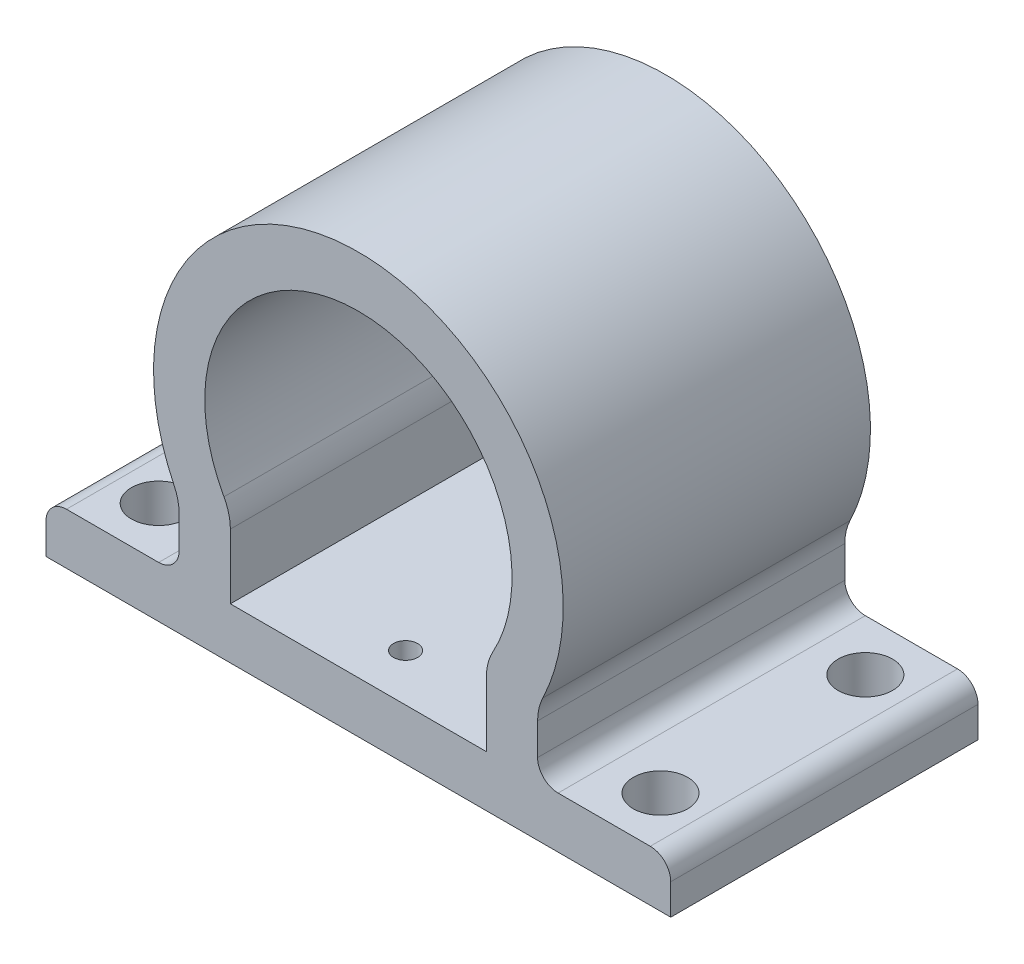
from build123d import *

# Parameters (mm, degrees)
BOSS_EXTRUDE1_DEPTH = 38.1
FILLET1_R           = 6.35
CUT_EXTRUDE1_REACH  = 71.34
SKETCH2_R           = 1.7
SKETCH2_3_R         = 3
SKETCH2_3_R_2       = 1.7
CUT_EXTRUDE2_DEPTH  = 6.35
SKETCH5_W           = 38.1
SKETCH5_H           = 6.35
BOSS_EXTRUDE3_DEPTH = 16.51
SKETCH6_R           = 3.3782
CUT_EXTRUDE3_DEPTH  = 76.254867783
FILLET2_R           = 2.54
BOSS_EXTRUDE4_START = -2.54
SKETCH7_R           = 3
SKETCH7_R_2         = 1.5
BOSS_EXTRUDE4_DEPTH = 2.54


with BuildPart() as part:
    # Sketch1 → Boss-Extrude1 (new body)
    with BuildSketch(Plane.XY):
        with BuildLine():
            Line((22.225, -26.67), (22.225, -12.296722124))
            ThreePointArc((22.225, -12.296722124), (0, 25.4), (-22.225, -12.296722124))
            Line((-22.225, -12.296722124), (-22.225, -26.67))
            Line((-22.225, -26.67), (22.225, -26.67))
        make_face()
        with BuildLine():
            Line((-15.875, -20.32), (15.875, -20.32))
            Line((15.875, -20.32), (15.875, -10.530283709))
            ThreePointArc((15.875, -10.530283709), (0, 19.05), (-15.875, -10.530283709))
            Line((-15.875, -10.530283709), (-15.875, -20.32))
        make_face(mode=Mode.SUBTRACT)
    extrude(amount=BOSS_EXTRUDE1_DEPTH)

    # Fillet1
    fillet1_edges = [part.edges().sort_by_distance(p)[0] for p in [
        (22.225, -12.296722124, 19.05),
        (15.875, -10.530283709, 19.05),
        (-22.225, -12.296722124, 19.05),
        (-15.875, -10.530283709, 19.05),
    ]]
    fillet(fillet1_edges, radius=FILLET1_R)

    # Sketch2 → Cut-Extrude1 (cut, up to next)
    with BuildSketch(Plane.XZ.offset(26.67), mode=Mode.PRIVATE) as cut_extrude1_sk1:
        with Locations((0, 32.2471478)):
            Circle(SKETCH2_R)
    cut_extrude1_tool1 = extrude(cut_extrude1_sk1.sketch, amount=-CUT_EXTRUDE1_REACH, mode=Mode.PRIVATE) & part.part
    # Sketch2 → Cut-Extrude1 (cut, up to next)
    with BuildSketch(Plane.XZ.offset(26.67), mode=Mode.PRIVATE) as cut_extrude1_sk2:
        with Locations((0, 13.2471478)):
            Circle(SKETCH2_R)
    cut_extrude1_tool2 = extrude(cut_extrude1_sk2.sketch, amount=-CUT_EXTRUDE1_REACH, mode=Mode.PRIVATE) & part.part
    add(cut_extrude1_tool1.solids().sort_by_distance((0, -26.67, 32.247148))[0], mode=Mode.SUBTRACT)
    add(cut_extrude1_tool2.solids().sort_by_distance((0, -26.67, 13.247148))[0], mode=Mode.SUBTRACT)

    # Sketch2<3> → Cut-Extrude2 (cut)
    # profile 1 of 2: a face of its own
    with BuildSketch(Plane.XZ.offset(26.67)):
        with Locations((0, 32.2471478)):
            Circle(SKETCH2_3_R)
        with Locations((0, 32.2471478)):
            Circle(SKETCH2_3_R_2, mode=Mode.SUBTRACT)
    # profile 2 of 2: a face of its own
    with BuildSketch(Plane.XZ.offset(26.67)):
        with Locations((0, 13.2471478)):
            Circle(SKETCH2_3_R)
        with Locations((0, 13.2471478)):
            Circle(SKETCH2_3_R_2, mode=Mode.SUBTRACT)
    extrude(amount=-CUT_EXTRUDE2_DEPTH, mode=Mode.SUBTRACT)

    # Sketch5 → Boss-Extrude3 (add)
    with BuildSketch(Plane.ZY.offset(22.225)):
        with Locations((19.05, -23.495)):
            Rectangle(SKETCH5_W, SKETCH5_H)
    boss_extrude3 = extrude(amount=BOSS_EXTRUDE3_DEPTH)

    # Sketch6 → Cut-Extrude3 (cut, through all)
    with BuildSketch(Plane(origin=(0, -26.67, 0), x_dir=(-1, 0, 0), z_dir=(0, -1, 0))):
        with Locations((31.115, -6.35)):
            Circle(SKETCH6_R)
        with Locations((31.115, -31.75)):
            Circle(SKETCH6_R)
    cut_extrude3 = extrude(amount=-CUT_EXTRUDE3_DEPTH, mode=Mode.SUBTRACT)

    # Mirror1: Boss-Extrude3, Cut-Extrude3 across plane
    add(boss_extrude3.mirror(Plane(origin=(0, 0, 0), x_dir=(0, 0, 1), z_dir=(1, 0, 0))))
    add(cut_extrude3.mirror(Plane(origin=(0, 0, 0), x_dir=(0, 0, 1), z_dir=(1, 0, 0))), mode=Mode.SUBTRACT)

    # Fillet2
    fillet2_edges = [part.edges().sort_by_distance(p)[0] for p in [
        (38.735, -20.32, 19.05),
        (22.225, -20.32, 19.05),
        (-38.735, -20.32, 19.05),
        (-22.225, -20.32, 19.05),
    ]]
    fillet(fillet2_edges, radius=FILLET2_R)

    # Sketch7 → Boss-Extrude4 (add)
    # profile 1 of 2: a face of its own
    with BuildSketch(Plane(origin=(0, -20.32, 0), x_dir=(1, 0, 0), z_dir=(0, 1, 0)).offset(BOSS_EXTRUDE4_START)):
        with Locations((0, -13.2471478)):
            Circle(SKETCH7_R)
        with Locations((0, -13.2471478)):
            Circle(SKETCH7_R_2, mode=Mode.SUBTRACT)
    # profile 2 of 2: a face of its own
    with BuildSketch(Plane(origin=(0, -20.32, 0), x_dir=(1, 0, 0), z_dir=(0, 1, 0)).offset(BOSS_EXTRUDE4_START)):
        with Locations((0, -32.2471478)):
            Circle(SKETCH7_R)
        with Locations((0, -32.2471478)):
            Circle(SKETCH7_R_2, mode=Mode.SUBTRACT)
    extrude(amount=BOSS_EXTRUDE4_DEPTH)


solid = part.part
